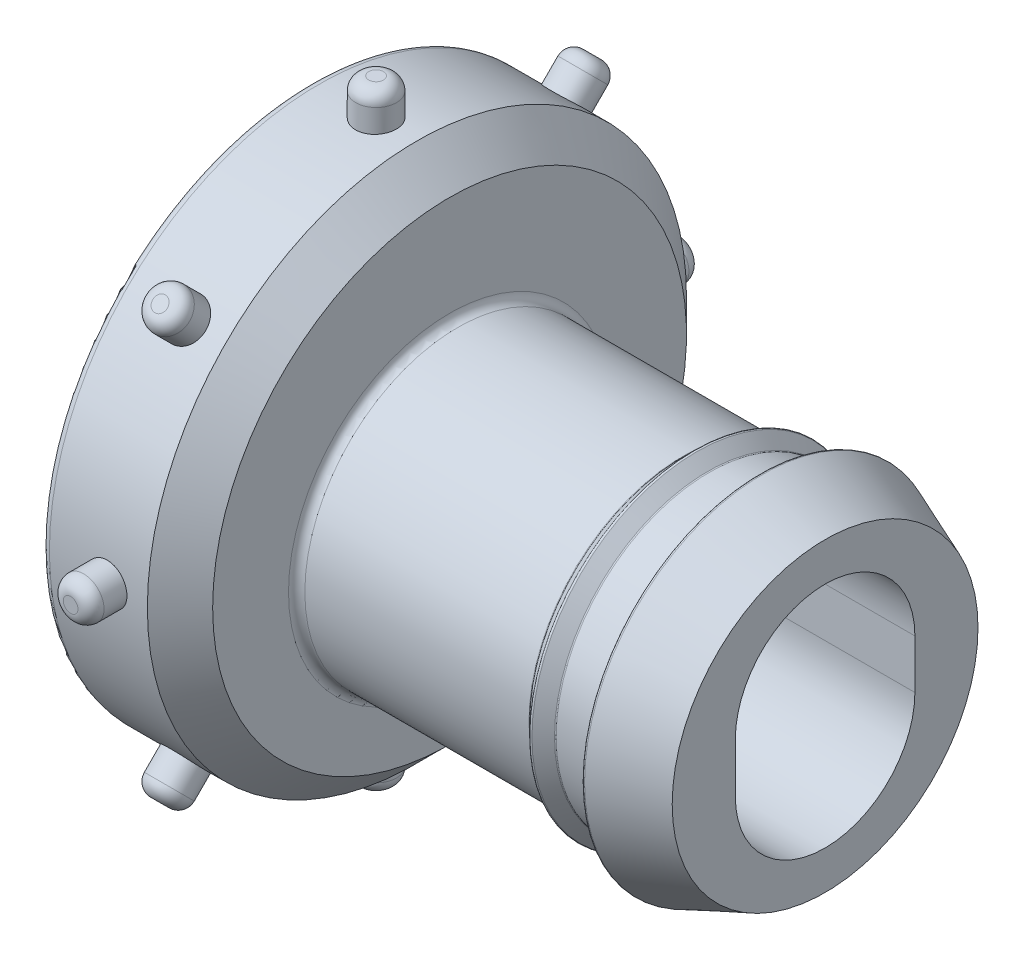
from build123d import *

# Parameters (mm, degrees)
SKETCH2_R                = 16.51
BOSS_EXTRUDE1_DEPTH      = 8.5
SKETCH4_W                = 18.18
SKETCH4_H                = 13.2
CUT_EXTRUDE1_DEPTH       = 7
SKETCH6_R                = 0.9
BOSS_EXTRUDE2_START      = -2
SKETCH7_R                = 1.25
BOSS_EXTRUDE2_DEPTH      = 4.2
FILLET2_R                = 0.8
CIRPATTERN1_COUNT        = 8
FILLET2_OF_CIRPATTERN1_R = 0.8
FILLET4_R                = 0.1
CUT_EXTRUDE2_DEPTH       = 36.8818645
CUT_EXTRUDE2_DEPTH_BACK  = 36.8818645
SKETCH8_W                = 3.59
SKETCH8_H                = 7.65
BOSS_EXTRUDE3_DEPTH      = 0.64
FILLET5_R                = 0.5
FILLET6_R                = 0.5
CHAMFER1_SIZE            = 2
FILLET7_R                = 1
CHAMFER2_SIZE            = 1
CHAMFER2_SIZE2           = 6
FILLET8_R                = 0.5


with BuildPart() as part:
    # Sketch1 → Revolve1 (revolve)
    with BuildSketch(Plane(origin=(0, 0, 0), x_dir=(1, 0, 0), z_dir=(0, 1, 0))):
        Polygon((0, 0), (-23, 0), (-23, 9.365), (-8.73, 9.365), (-7.94, 10.155), (-7.15, 9.365), (-3.97, 9.365), (-3.97, 10.955), (0, 9.365), align=None)
    revolve(axis=Axis((0, 0, 0), (-1, 0, 0)))

    # Sketch2 → Boss-Extrude1 (add)
    with BuildSketch(Plane.ZY.offset(23)):
        with Locations((0, 1.5)):
            Circle(SKETCH2_R)
        with BuildLine():
            ThreePointArc((-5.5, 1.5), (0, 7), (5.5, 1.5))
            Line((5.5, 1.5), (5.5, -1.5))
            ThreePointArc((5.5, -1.5), (0, -7), (-5.5, -1.5))
            Line((-5.5, -1.5), (-5.5, 1.5))
        make_face(mode=Mode.SUBTRACT)
    extrude(amount=BOSS_EXTRUDE1_DEPTH)

    # Sketch4 → Cut-Extrude1 (cut)
    with BuildSketch(Plane.ZY.offset(31.5)):
        with Locations((0, 1.029757623)):
            Rectangle(SKETCH4_W, SKETCH4_H)
    extrude(amount=-CUT_EXTRUDE1_DEPTH, mode=Mode.SUBTRACT)

    # Sketch6 → Cut-Revolve1 (revolve, cut)
    with BuildSketch(Plane.XY, mode=Mode.PRIVATE) as cut_revolve1_sk:
        with Locations((-31.5, 15.64)):
            Circle(SKETCH6_R)
    revolve(cut_revolve1_sk.sketch.rotate(Axis((-31.5, 1.5, 0), (1, 0, 0)), 90), axis=Axis((-31.5, 1.5, 0), (1, 0, 0)), mode=Mode.SUBTRACT)

    # Sketch7 → Boss-Extrude2 (add)
    with BuildSketch(Plane(origin=(0, 18.01, 0), x_dir=(1, 0, 0), z_dir=(0, 1, 0)).offset(BOSS_EXTRUDE2_START)):
        with Locations(Location((-27.5, 0, 0), (0, 0, 270))):
            Circle(SKETCH7_R)
    boss_extrude2 = extrude(amount=BOSS_EXTRUDE2_DEPTH)

    # Fillet2
    fillet2_edges = [part.edges().sort_by_distance(p)[0] for p in [
        (-27.5, 20.21, -1.25),
    ]]
    fillet(fillet2_edges, radius=FILLET2_R)

    # CirPattern1: Boss-Extrude2 ×8 about axis
    cirpattern1_axis = Axis((0, 1.5, 0), (1, 0, 0))
    for i in range(1, CIRPATTERN1_COUNT):
        add(boss_extrude2.rotate(cirpattern1_axis, i * 360 / CIRPATTERN1_COUNT))

    # Fillet2 of CirPattern1
    fillet2_of_cirpattern1_edges = [part.edges().sort_by_distance(p)[0] for p in [
        (-27.5, 15.613851352, 12.3460844),
        (-27.5, 2.75, 18.71),
        (-27.5, -10.8460844, 14.113851352),
        (-27.5, -17.21, 1.25),
        (-27.5, -12.613851352, -12.3460844),
        (-27.5, 0.25, -18.71),
        (-27.5, 13.8460844, -14.113851352),
    ]]
    fillet(fillet2_of_cirpattern1_edges, radius=FILLET2_OF_CIRPATTERN1_R)

    # Fillet4
    fillet4_edges = [part.edges().sort_by_distance(p)[0] for p in [
        (-3.97, 0, 9.365),
        (-3.97, 0, 10.955),
        (-8.73, 0, 9.365),
        (-7.94, 0, 10.155),
        (-7.15, 0, 9.365),
    ]]
    fillet(fillet4_edges, radius=FILLET4_R)

    # Sketch2<3> → Cut-Extrude2 (cut, two sides: drawn at the far end of the back side and taken through both)
    with BuildSketch(Plane.ZY.offset(23).offset(-CUT_EXTRUDE2_DEPTH_BACK)):
        with BuildLine():
            Line((5.5, 0), (5.5, 1.5))
            ThreePointArc((5.5, 1.5), (0, 7), (-5.5, 1.5))
            Line((-5.5, 1.5), (-5.5, 0))
            Line((-5.5, 0), (-5.5, -1.5))
            ThreePointArc((-5.5, -1.5), (0, -7), (5.5, -1.5))
            Line((5.5, -1.5), (5.5, 0))
        make_face()
    extrude(amount=CUT_EXTRUDE2_DEPTH + CUT_EXTRUDE2_DEPTH_BACK, mode=Mode.SUBTRACT)

    # Sketch8 → Boss-Extrude3 (add)
    with BuildSketch(Plane.ZY.offset(24.5)):
        with Locations((7.295, -1.745242377)):
            Rectangle(SKETCH8_W, SKETCH8_H)
    extrude(amount=BOSS_EXTRUDE3_DEPTH)

    # Fillet5
    fillet5_edges = [part.edges().sort_by_distance(p)[0] for p in [
        (-25.14, -1.745242377, 5.5),
        (-25.14, 2.079757623, 7.295),
    ]]
    fillet(fillet5_edges, radius=FILLET5_R)

    # Fillet6
    fillet6_edges = [part.edges().sort_by_distance(p)[0] for p in [
        (-23, 0, 9.365),
    ]]
    fillet(fillet6_edges, radius=FILLET6_R)

    # Chamfer1
    chamfer1_edges = [part.edges().sort_by_distance(p)[0] for p in [
        (-23, 1.5, -16.51),
    ]]
    chamfer(chamfer1_edges, length=CHAMFER1_SIZE)

    # Fillet7
    fillet7_edges = [part.edges().sort_by_distance(p)[0] for p in [
        (-31.5, 1.5, -13.24),
    ]]
    fillet(fillet7_edges, radius=FILLET7_R)

    # Chamfer2
    chamfer2_edges = [part.edges().sort_by_distance(p)[0] for p in [
        (-31.5, 7.629757623, 0),
    ]]
    chamfer2_side = [part.faces().sort_by_distance(p)[0] for p in [
        (-31.5, 1.5, -12.170205593),
    ]]
    chamfer(chamfer2_edges, length=CHAMFER2_SIZE, length2=CHAMFER2_SIZE2, reference=chamfer2_side[0])

    # Fillet8
    fillet8_edges = [part.edges().sort_by_distance(p)[0] for p in [
        (-31.5, 1.5, -16.51),
    ]]
    fillet(fillet8_edges, radius=FILLET8_R)


solid = part.part
